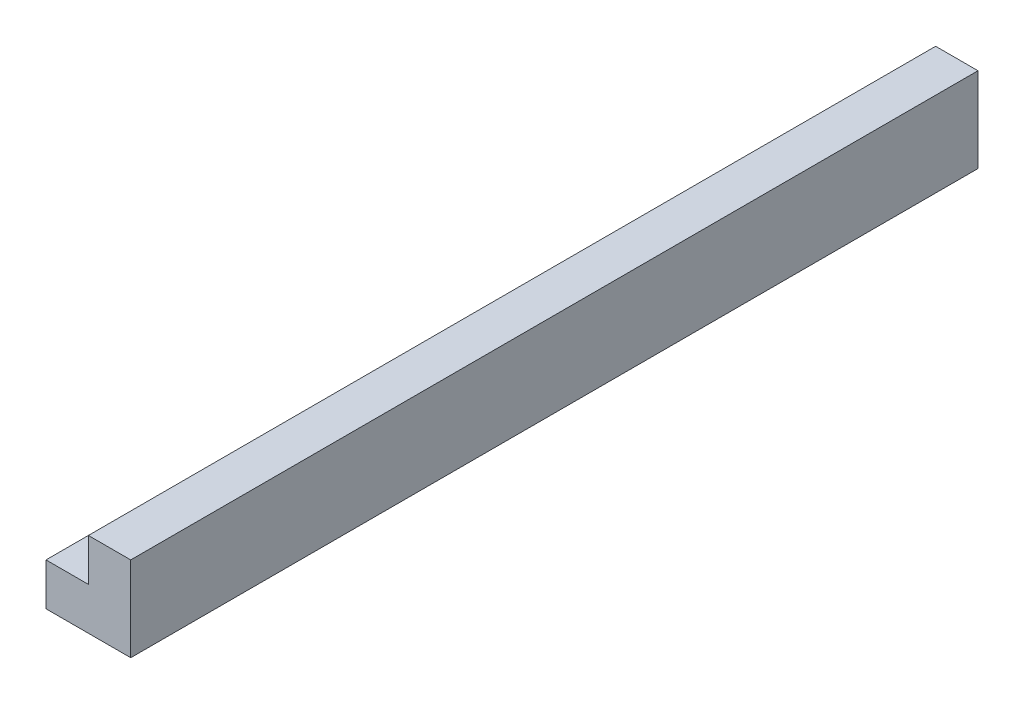
from build123d import *

# Parameters (mm, degrees)
BOSS_EXTRU_1_DEPTH = 200


with BuildPart() as part:
    # Esquisse1 → Boss.-Extru.1 (new body)
    with BuildSketch(Plane.XY):
        Polygon((0, 0), (20, 0), (20, 20), (10, 20), (10, 10), (0, 10), align=None)
    extrude(amount=BOSS_EXTRU_1_DEPTH)


solid = part.part
